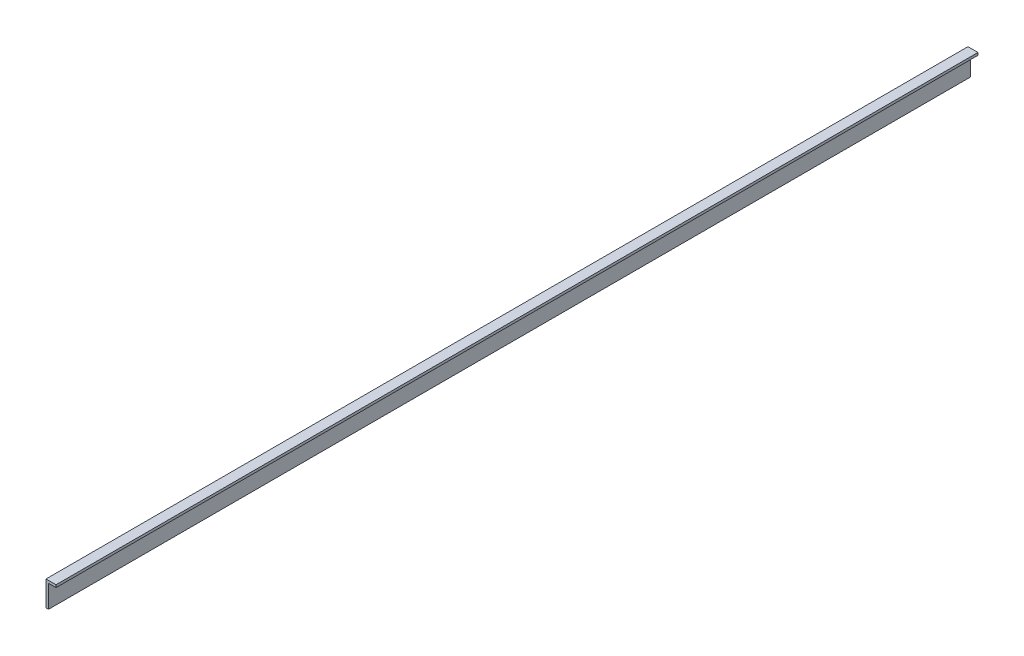
from build123d import *

# Parameters (mm, degrees)
STORE_KASET_L_RAF_3_SOL_1_START = -20
STORE_KASET_L_RAF_3_SOL_1_DEPTH = 735.5


with BuildPart() as part:
    # Sketch1 → STORE_kaset_L_raf_3_sol_1 (new body)
    with BuildSketch(Plane.XY.offset(STORE_KASET_L_RAF_3_SOL_1_START)):
        Polygon((393.5, 404.5), (391.5, 404.5), (391.5, 424.5), (399.5, 424.5), (399.5, 422.5), (393.5, 422.5), align=None)
    extrude(amount=-STORE_KASET_L_RAF_3_SOL_1_DEPTH)


solid = part.part
